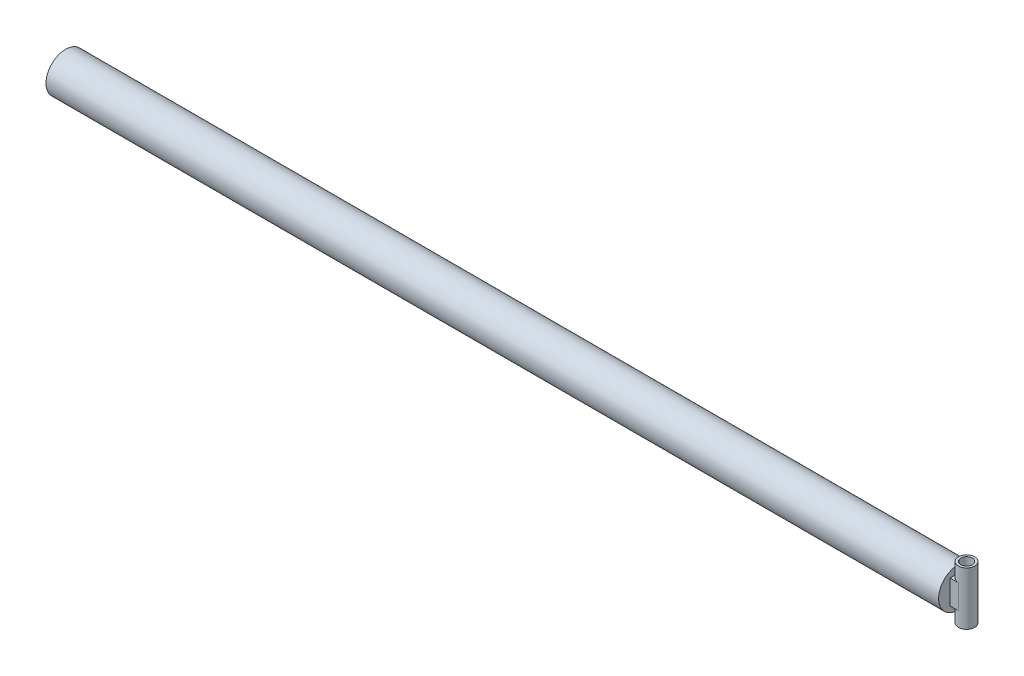
from build123d import *

# Parameters (mm, degrees)
CILINDAR_SHELL1_T                 = -10
CILINDAR_SKETCH3_W                = 30
CILINDAR_SKETCH3_H                = 10
CILINDAR_BOSS_EXTRUDE1_DEPTH      = 115
CILINDAR_BOSS_EXTRUDE1_DEPTH_BACK = 115
CILINDAR_SKETCH2_R                = 35
CILINDAR_SKETCH2_R_2              = 25
CILINDAR_BOSS_EXTRUDE7_REACH      = 3864.648
CILINDAR_SKETCH6_W                = 70
CILINDAR_SKETCH6_H                = 105
CILINDAR_SKETCH7_R                = 65
CILINDAR_SKETCH7_R_2              = 18.75
CILINDAR_BOSS_EXTRUDE8_DEPTH      = 10


with BuildPart() as part:
    # cilindar_Sketch1 → cilindar_Revolve1 (revolve)
    with BuildSketch(Plane(origin=(0, 0, 0), x_dir=(1, 0, 0), z_dir=(0, 1, 0))):
        Polygon((-1930, 75), (-1930, 0), (1930, 0), (1930, 75), (1900, 75), (1900, 85), (-1900, 85), (-1900, 75), align=None)
    revolve(axis=Axis((-1930, 0, 0), (1, 0, 0)))

    # cilindar_Shell1
    cilindar_shell1_openings = [part.faces().sort_by_distance(p)[0] for p in [
        (-1930, 0, 0),
    ]]
    offset(amount=CILINDAR_SHELL1_T, openings=cilindar_shell1_openings, kind=Kind.INTERSECTION)

    # cilindar_Sketch3 → cilindar_Revolve2 (revolve)
    with BuildSketch(Plane(origin=(0, 0, 0), x_dir=(1, 0, 0), z_dir=(0, 1, 0))):
        with Locations((-1915, 80)):
            Rectangle(CILINDAR_SKETCH3_W, CILINDAR_SKETCH3_H)
    cilindar_revolve2 = revolve(axis=Axis((1890, 0, 0), (-1, 0, 0)))

    # cilindar_Mirror2: cilindar_Revolve2 across plane
    add(cilindar_revolve2.mirror(Plane(origin=(0, 0, 0), x_dir=(0, 0, 1), z_dir=(1, 0, 0))))


with BuildPart() as body_2:
    # cilindar_Sketch2 → cilindar_Boss-Extrude1 (new, two sides: drawn at the far end of the back side and taken through both)
    with BuildSketch(Plane(origin=(0, 0, 0), x_dir=(1, 0, 0), z_dir=(0, 1, 0)).offset(-CILINDAR_BOSS_EXTRUDE1_DEPTH_BACK)):
        with Locations((1966, 0)):
            Circle(CILINDAR_SKETCH2_R)
        with Locations((1966, 0)):
            Circle(CILINDAR_SKETCH2_R_2, mode=Mode.SUBTRACT)
    extrude(amount=CILINDAR_BOSS_EXTRUDE1_DEPTH + CILINDAR_BOSS_EXTRUDE1_DEPTH_BACK)

    # cilindar_Sketch6 → cilindar_Boss-Extrude7 (add, up to next)
    with BuildSketch(Plane(origin=(1930, 0, 0), x_dir=(0, 0, -1), z_dir=(1, 0, 0)), mode=Mode.PRIVATE) as cilindar_boss_extrude7_sk1:
        Rectangle(CILINDAR_SKETCH6_W, CILINDAR_SKETCH6_H)
    cilindar_boss_extrude7_tool1 = extrude(cilindar_boss_extrude7_sk1.sketch, amount=CILINDAR_BOSS_EXTRUDE7_REACH, mode=Mode.PRIVATE) - body_2.part

    add(part.part)  # cilindar_Boss-Extrude7 merges part
    add(cilindar_boss_extrude7_tool1.solids().sort_by_distance((1930, 0, 0))[0])

    # cilindar_Sketch7 → cilindar_Boss-Extrude8 (add)
    with BuildSketch(Plane.ZY.offset(1930)):
        Circle(CILINDAR_SKETCH7_R)
        Circle(CILINDAR_SKETCH7_R_2, mode=Mode.SUBTRACT)
    extrude(amount=-CILINDAR_BOSS_EXTRUDE8_DEPTH)


solid = body_2.part
